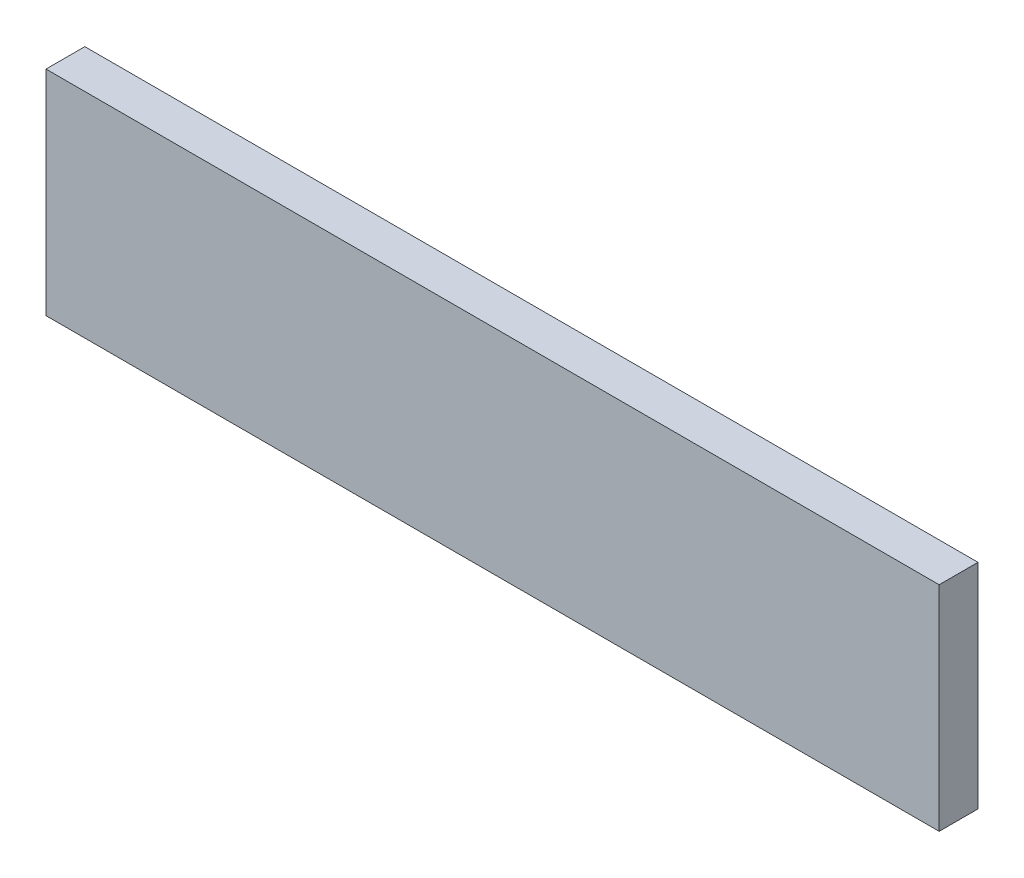
from build123d import *

# Parameters (mm, degrees)
SKETCH1_W           = 146.05
SKETCH1_H           = 34.925
BOSS_EXTRUDE1_DEPTH = 3.175


with BuildPart() as part:
    # Sketch1 → Boss-Extrude1 (new, symmetric)
    with BuildSketch(Plane.XY):
        Rectangle(SKETCH1_W, SKETCH1_H)
    extrude(amount=BOSS_EXTRUDE1_DEPTH, both=True)


solid = part.part
